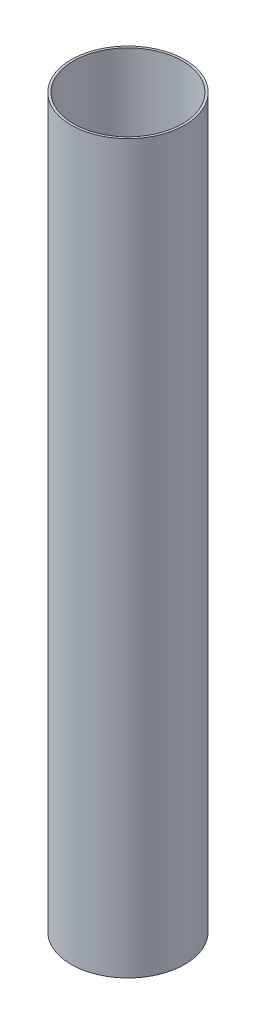
from build123d import *

# Parameters (mm, degrees)
SKETCH2_R           = 39.6748
SKETCH2_R_2         = 38.1
BOSS_EXTRUDE1_DEPTH = 254


with BuildPart() as part:
    # Sketch2 → Boss-Extrude1 (new, symmetric)
    with BuildSketch(Plane(origin=(0, 0, 0), x_dir=(1, 0, 0), z_dir=(0, 1, 0))):
        with Locations(Location((0, 0, 0), (0, 0, 270))):
            Circle(SKETCH2_R)
        with Locations(Location((0, 0, 0), (0, 0, 270))):
            Circle(SKETCH2_R_2, mode=Mode.SUBTRACT)
    extrude(amount=BOSS_EXTRUDE1_DEPTH, both=True)


solid = part.part
